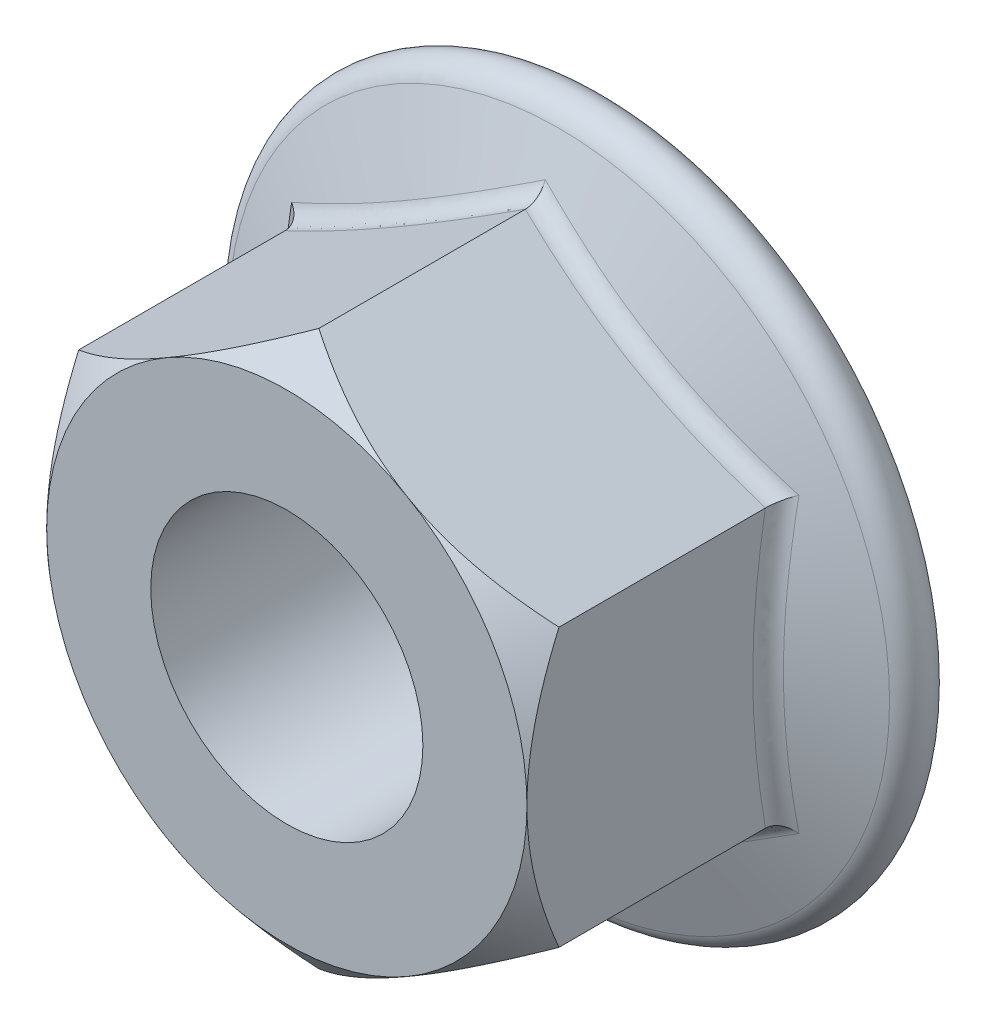
from build123d import *

# Parameters (mm, degrees)
BASENUTSKE_R   = 5.1
BASENUT_DEPTH  = 12
FLANGEFILLET_R = 0.72


with BuildPart() as part:
    # BaseNutSke → BaseNut (new body)
    with BuildSketch(Plane.XY):
        Polygon((9, 5.196152423), (9, -5.196152423), (0, -10.392304845), (-9, -5.196152423), (-9, 5.196152423), (0, 10.392304845), align=None)
        Circle(BASENUTSKE_R, mode=Mode.SUBTRACT)
    extrude(amount=-BASENUT_DEPTH)

    # Sketch6 → Flange (revolve)
    with BuildSketch(Plane(origin=(0, 0, 0), x_dir=(0, 0, -1), z_dir=(1, 0, 0)), mode=Mode.PRIVATE) as flange_sk:
        with BuildLine():
            Line((7.546873015, 5.1), (10.2, 12.389406482))
            ThreePointArc((10.2, 12.389406482), (11.233160314, 12.985901867), (12, 12.072017916))
            Line((12, 12.072017916), (12, 5.1))
            Line((12, 5.1), (7.546873015, 5.1))
        make_face()
    revolve(flange_sk.sketch.rotate(Axis((0, 0, 0), (0, 0, -1)), 90), axis=Axis((0, 0, 0), (0, 0, -1)))

    # Sketch3 → Double-Chamfer (revolve, cut)
    with BuildSketch(Plane(origin=(0, 0, 0), x_dir=(0, 0, -1), z_dir=(1, 0, 0)), mode=Mode.PRIVATE) as double_chamfer_sk:
        Polygon((1.2, 23.092304845), (-12.7, 23.092304845), (-12.7, 9), (0, 9), (1.2, 10.392304845), align=None)
    revolve(double_chamfer_sk.sketch.rotate(Axis((0, 0, 0), (0, 0, -1)), 90), axis=Axis((0, 0, 0), (0, 0, -1)), mode=Mode.SUBTRACT)

    # FlangeFillet
    flangefillet_edges = [part.edges().sort_by_distance(p)[0] for p in [
        (9, -2.609409864, -9.1012613),
        (9, 2.609409864, -9.1012613),
        (4.5, -7.794228634, -8.966356929),
        (4.5, 7.794228634, -8.966356929),
        (-4.5, 7.794228634, -8.966356929),
        (-9, 0, -8.966356929),
        (-4.5, -7.794228634, -8.966356929),
    ]]
    fillet(flangefillet_edges, radius=FLANGEFILLET_R)


solid = part.part
